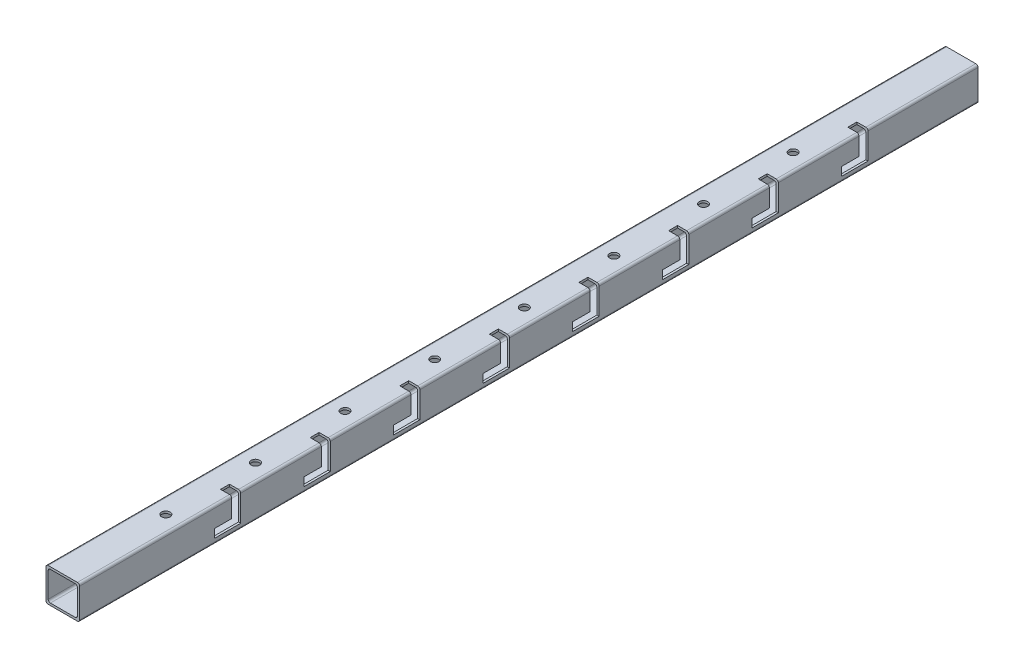
from build123d import *

# Parameters (mm, degrees)
SKETCH3_W           = 19.05
SKETCH3_H           = 19.05
SKETCH3_W_2         = 16.5608
SKETCH3_H_2         = 16.5608
BOSS_EXTRUDE1_DEPTH = 254.635
FILLET1_R           = 1.2446
SKETCH4_R           = 2.413
CUT_EXTRUDE1_DEPTH  = 256.524189364
CUT_EXTRUDE3_START  = -19.05
CUT_EXTRUDE3_DEPTH  = 6.35
LPATTERN2_COUNT     = 8
LPATTERN2_PITCH     = 50.8


with BuildPart() as part:
    # Sketch3 → Boss-Extrude1 (new, symmetric)
    with BuildSketch(Plane.XY):
        Rectangle(SKETCH3_W, SKETCH3_H)
        Rectangle(SKETCH3_W_2, SKETCH3_H_2, mode=Mode.SUBTRACT)
    extrude(amount=BOSS_EXTRUDE1_DEPTH, both=True)

    # Fillet1
    fillet1_edges = [part.edges().sort_by_distance(p)[0] for p in [
        (-8.2804, -8.2804, 0),
        (8.2804, -8.2804, 0),
        (8.2804, 8.2804, 0),
        (-8.2804, 8.2804, 0),
        (9.525, -9.525, 0),
        (-9.525, -9.525, 0),
        (-9.525, 9.525, 0),
        (9.525, 9.525, 0),
    ]]
    fillet(fillet1_edges, radius=FILLET1_R)

    # Sketch4 → Cut-Extrude1 (cut, through all)
    with BuildSketch(Plane(origin=(0, 9.525, 0), x_dir=(1, 0, 0), z_dir=(0, 1, 0))):
        with Locations(Location((0, 159.385, 0), (0, 0, 270))):
            Circle(SKETCH4_R)
        with Locations(Location((0, 108.585, 0), (0, 0, 270))):
            Circle(SKETCH4_R)
        with Locations(Location((0, 57.785, 0), (0, 0, 270))):
            Circle(SKETCH4_R)
        with Locations(Location((0, 6.985, 0), (0, 0, 270))):
            Circle(SKETCH4_R)
        with Locations(Location((0, -43.815, 0), (0, 0, 270))):
            Circle(SKETCH4_R)
        with Locations(Location((0, -94.615, 0), (0, 0, 270))):
            Circle(SKETCH4_R)
        with Locations(Location((0, -145.415, 0), (0, 0, 270))):
            Circle(SKETCH4_R)
        with Locations(Location((0, -196.215, 0), (0, 0, 270))):
            Circle(SKETCH4_R)
    extrude(amount=-CUT_EXTRUDE1_DEPTH, mode=Mode.SUBTRACT)

    # Sketch6 → Cut-Extrude3 (cut)
    with BuildSketch(Plane.ZY.offset(9.525).offset(CUT_EXTRUDE3_START)):
        Polygon((-182.118, -1.651), (-187.198, -1.651), (-187.198, 9.525), (-192.278, 9.525), (-192.278, -6.477), (-182.118, -6.477), (-177.292, -6.477), (-177.292, -1.651), align=None)
    cut_extrude3 = extrude(amount=CUT_EXTRUDE3_DEPTH, mode=Mode.SUBTRACT)

    # LPattern2: Cut-Extrude3 ×8
    with Locations(*[(0, 0, i * LPATTERN2_PITCH) for i in range(1, LPATTERN2_COUNT)]):
        add(cut_extrude3, mode=Mode.SUBTRACT)


solid = part.part
